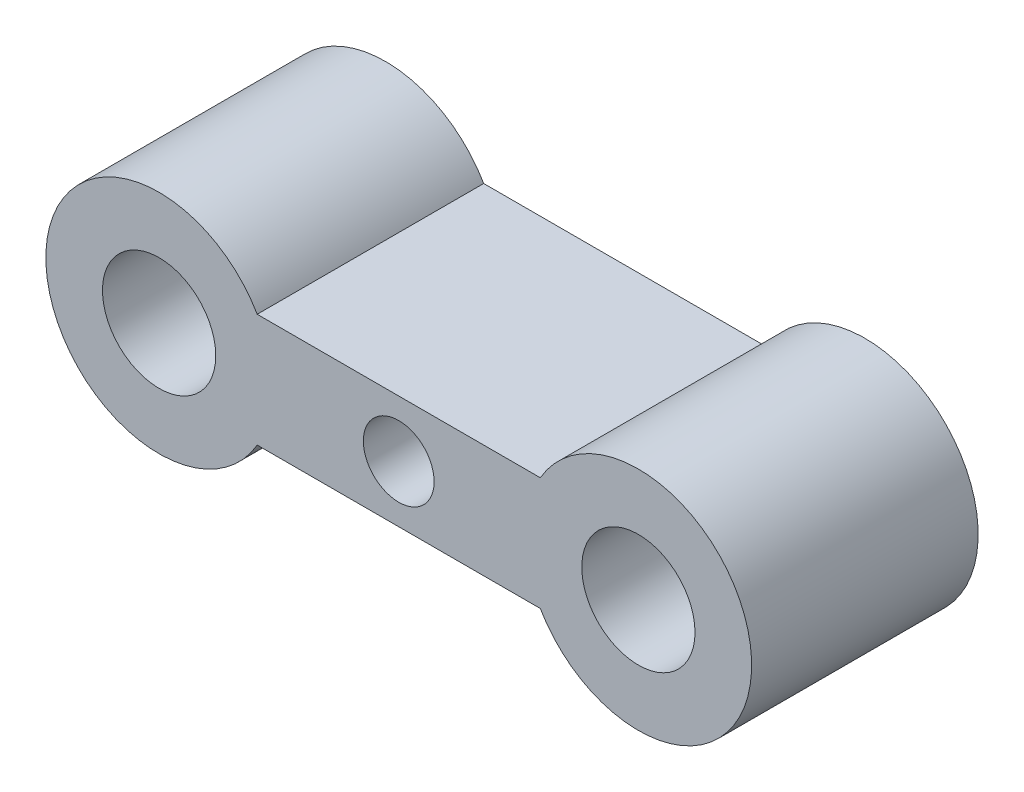
from build123d import *

# Parameters (mm, degrees)
CROQUIS1_R              = 4
CROQUIS1_R_2            = 2
SALIENTE_EXTRUIR1_DEPTH = 8
CROQUIS3_R              = 1.25
CORTAR_EXTRUIR1_DEPTH   = 21.5


with BuildPart() as part:
    # Croquis1 → Saliente-Extruir1 (new body)
    # profile 1 of 4: a face of its own
    with BuildSketch(Plane.XY):
        Circle(CROQUIS1_R)
        Circle(CROQUIS1_R_2, mode=Mode.SUBTRACT)
    # profile 2 of 4: a face of its own
    with BuildSketch(Plane.XY):
        with BuildLine():
            Line((8.464101615, 2), (3.464101615, 2))
            ThreePointArc((3.464101615, 2), (3.863703305, 1.03527618), (4, 0))
            ThreePointArc((4, 0), (3.863703305, -1.03527618), (3.464101615, -2))
            Line((3.464101615, -2), (8.464101615, -2))
            Line((8.464101615, -2), (8.464101615, 2))
        make_face()
    # profile 3 of 4: a face of its own
    with BuildSketch(Plane.XY):
        with BuildLine():
            Line((13.464101615, 2), (8.464101615, 2))
            Line((8.464101615, 2), (8.464101615, -2))
            Line((8.464101615, -2), (13.464101615, -2))
            ThreePointArc((13.464101615, -2), (12.92820323, 0), (13.464101615, 2))
        make_face()
    # profile 4 of 4: a face of its own
    with BuildSketch(Plane.XY):
        with Locations((16.92820323, 0)):
            Circle(CROQUIS1_R)
        with Locations((16.92820323, 0)):
            Circle(CROQUIS1_R_2, mode=Mode.SUBTRACT)
    extrude(amount=SALIENTE_EXTRUIR1_DEPTH)

    # Croquis3 → Cortar-Extruir1 (cut)
    with BuildSketch(Plane(origin=(0, 0, 0), x_dir=(-1, 0, 0), z_dir=(0, 0, -1))):
        with Locations((-8.464101615, 0)):
            Circle(CROQUIS3_R)
    extrude(amount=-CORTAR_EXTRUIR1_DEPTH, mode=Mode.SUBTRACT)


solid = part.part
